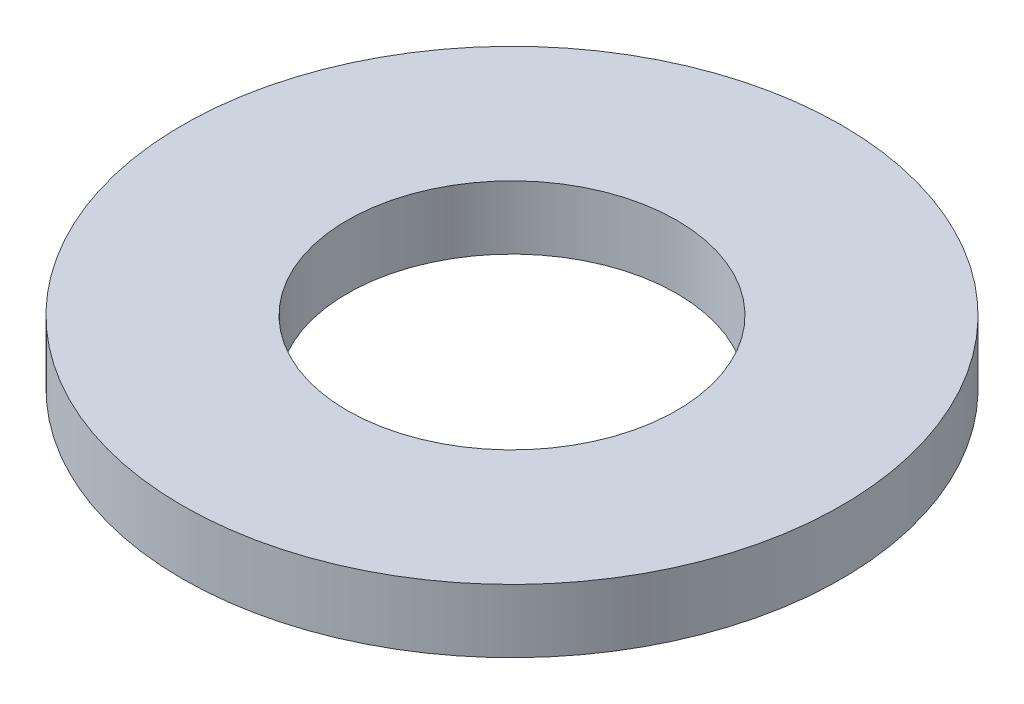
from build123d import *

# Parameters (mm, degrees)
SKETCH1_R           = 4
SKETCH1_R_2         = 2
BOSS_EXTRUDE1_DEPTH = 0.77


with BuildPart() as part:
    # Sketch1 → Boss-Extrude1 (new body)
    with BuildSketch(Plane(origin=(0, 0, 0), x_dir=(1, 0, 0), z_dir=(0, 1, 0))):
        with Locations(Location((5.584813224, 0, 0), (0, 0, 270))):
            Circle(SKETCH1_R)
        with Locations(Location((5.584813224, 0, 0), (0, 0, 270))):
            Circle(SKETCH1_R_2, mode=Mode.SUBTRACT)
    extrude(amount=BOSS_EXTRUDE1_DEPTH)


solid = part.part
